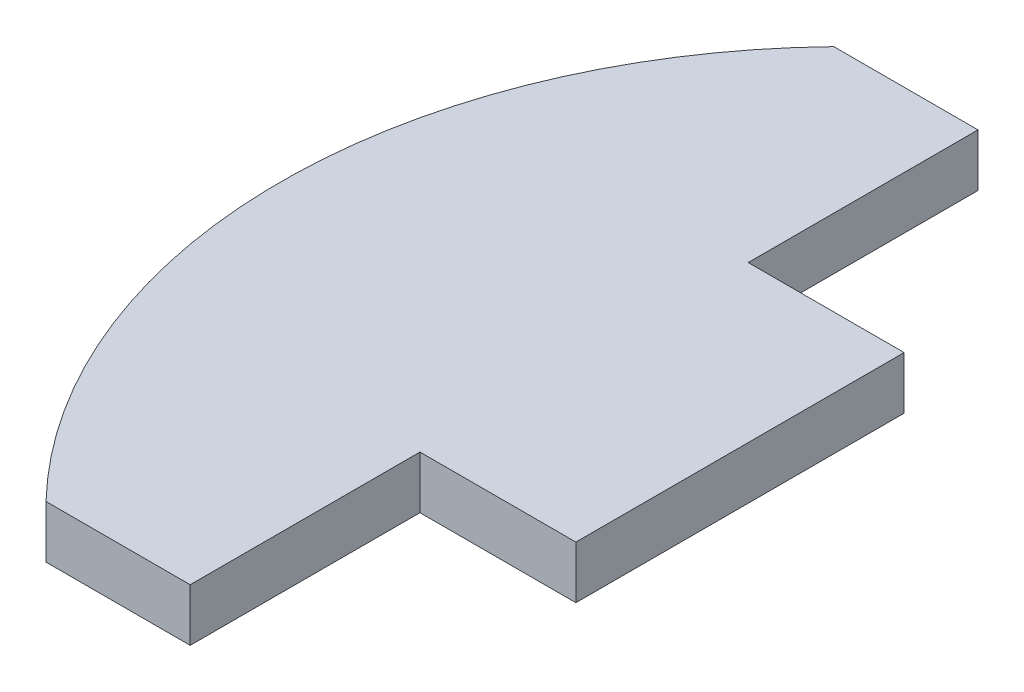
from build123d import *

# Parameters (mm, degrees)
BOSS_EXTRUDE1_DEPTH = 1.6


with BuildPart() as part:
    # Sketch1 → Boss-Extrude1 (new body)
    with BuildSketch(Plane(origin=(0, 0, 0), x_dir=(1, 0, 0), z_dir=(0, 1, 0))):
        with BuildLine():
            Line((-3.25, 0), (-17.25, 0))
            ThreePointArc((-17.25, 0), (-15.989450927, -6.473017771), (-12.392033731, -12))
            Line((-12.392033731, -12), (-8, -12))
            Line((-8, -12), (-8, -5))
            Line((-8, -5), (-3.25, -5))
            Line((-3.25, -5), (-3.25, 0))
        make_face()
        with BuildLine():
            Line((-8, 12), (-12.392033731, 12))
            ThreePointArc((-12.392033731, 12), (-15.989450927, 6.473017771), (-17.25, 0))
            Line((-17.25, 0), (-3.25, 0))
            Line((-3.25, 0), (-3.25, 5))
            Line((-3.25, 5), (-8, 5))
            Line((-8, 5), (-8, 12))
        make_face()
    extrude(amount=BOSS_EXTRUDE1_DEPTH)


solid = part.part
